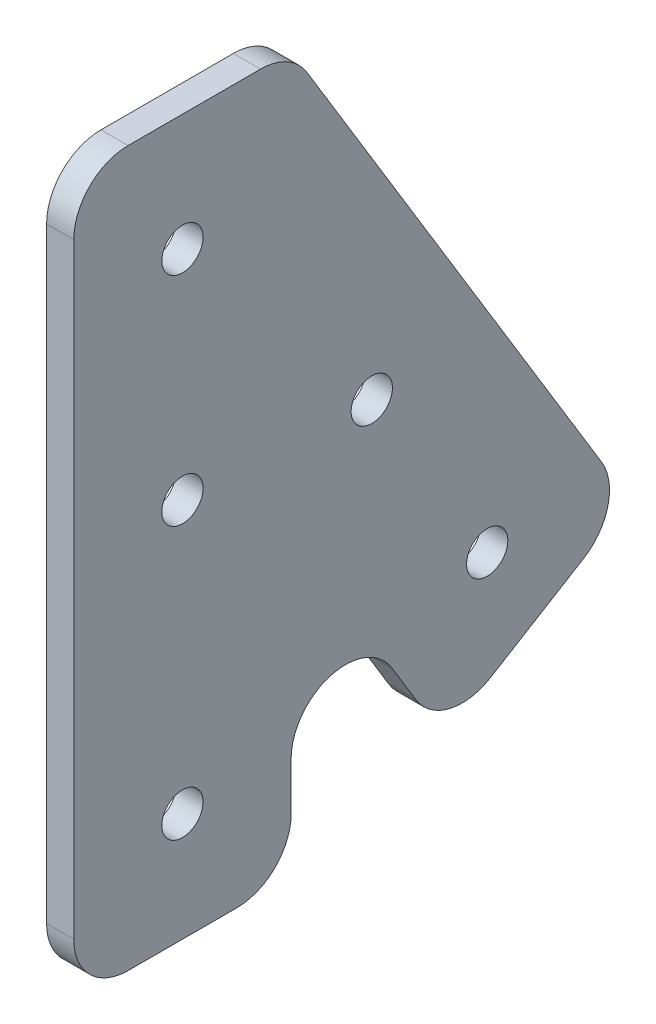
from build123d import *

# Parameters (mm, degrees)
BOSS_EXTRUDE1_DEPTH = 3.175
SKETCH2_R           = 2.413
CUT_EXTRUDE1_DEPTH  = 105.401092279


with BuildPart() as part:
    # Sketch1 → Boss-Extrude1 (new body)
    with BuildSketch(Plane(origin=(0, 0, 0), x_dir=(0, 0, -1), z_dir=(1, 0, 0))):
        with BuildLine():
            Line((27.254915981, 80.437799327), (61.677992598, 23.799518102))
            ThreePointArc((61.677992598, 23.799518102), (62.420677668, 18.996519818), (59.549602661, 15.075129511))
            Line((59.549602661, 15.075129511), (48.696824135, 8.479130857))
            ThreePointArc((48.696824135, 8.479130857), (43.89382585, 7.736445787), (39.972435544, 10.607520794))
            Line((39.972435544, 10.607520794), (37.176389263, 15.208017644))
            ThreePointArc((37.176389263, 15.208017644), (30.037556106, 18.024757552), (25.4, 11.910018317))
            Line((25.4, 11.910018317), (25.4, 6.35))
            ThreePointArc((25.4, 6.35), (23.540128061, 1.859871939), (19.05, 0))
            Line((19.05, 0), (6.35, 0))
            ThreePointArc((6.35, 0), (1.859871939, 1.859871939), (0, 6.35))
            Line((0, 6.35), (0, 77.1398))
            ThreePointArc((0, 77.1398), (1.859871939, 81.629928061), (6.35, 83.4898))
            Line((6.35, 83.4898), (21.828526718, 83.4898))
            ThreePointArc((21.828526718, 83.4898), (24.941419607, 82.674454268), (27.254915981, 80.437799327))
        make_face()
    extrude(amount=BOSS_EXTRUDE1_DEPTH)

    # Sketch2 → Cut-Extrude1 (cut, through all)
    with BuildSketch(Plane(origin=(3.175, 0, 0), x_dir=(0, 0, -1), z_dir=(1, 0, 0))):
        with Locations((12.7, 12.7)):
            Circle(SKETCH2_R)
        with Locations((12.7, 44.45)):
            Circle(SKETCH2_R)
        with Locations((12.7, 69.85)):
            Circle(SKETCH2_R)
        with Locations((34.821609996, 43.535175921)):
            Circle(SKETCH2_R)
        with Locations((48.30950313, 21.342764331)):
            Circle(SKETCH2_R)
    extrude(amount=-CUT_EXTRUDE1_DEPTH, mode=Mode.SUBTRACT)


solid = part.part
